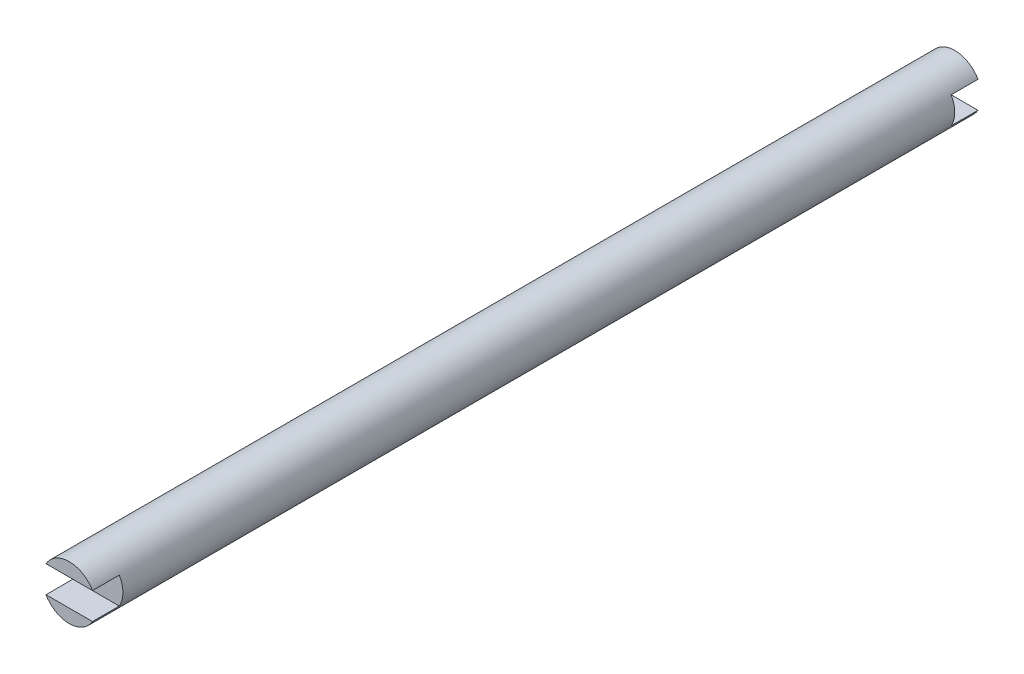
from build123d import *

# Parameters (mm, degrees)
ESQUISSE1_R             = 2
BOSS_EXTRU_1_DEPTH      = 66
ESQUISSE2_W             = 7.5
ESQUISSE2_H             = 2
ENL_V_MAT_EXTRU_1_DEPTH = 2
ESQUISSE3_W             = 7.5
ESQUISSE3_H             = 2
ENL_V_MAT_EXTRU_2_DEPTH = 2


with BuildPart() as part:
    # Esquisse1 → Boss.-Extru.1 (new body)
    with BuildSketch(Plane.XY):
        Circle(ESQUISSE1_R)
    extrude(amount=BOSS_EXTRU_1_DEPTH)

    # Esquisse2 → Enlèv. mat.-Extru.1 (cut)
    with BuildSketch(Plane.XY.offset(66)):
        Rectangle(ESQUISSE2_W, ESQUISSE2_H)
    extrude(amount=-ENL_V_MAT_EXTRU_1_DEPTH, mode=Mode.SUBTRACT)

    # Esquisse3 → Enlèv. mat.-Extru.2 (cut)
    with BuildSketch(Plane(origin=(0, 0, 0), x_dir=(-1, 0, 0), z_dir=(0, 0, -1))):
        Rectangle(ESQUISSE3_W, ESQUISSE3_H)
    extrude(amount=-ENL_V_MAT_EXTRU_2_DEPTH, mode=Mode.SUBTRACT)


solid = part.part
